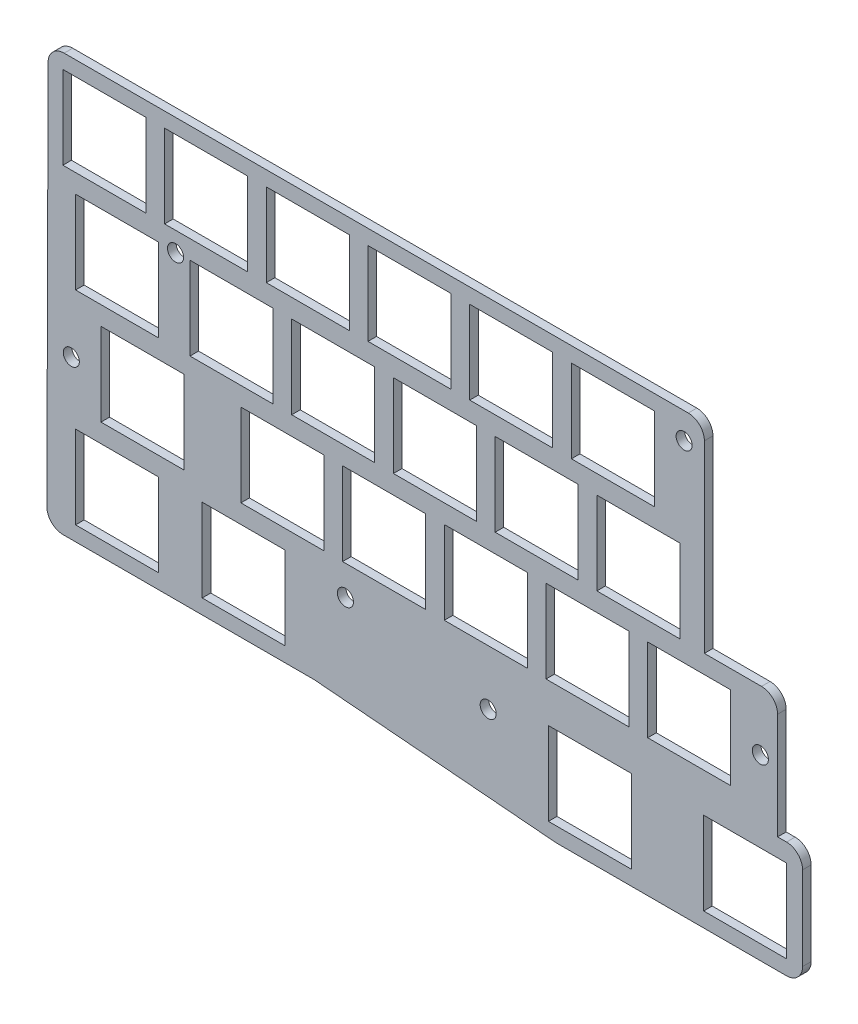
from build123d import *

# Parameters (mm, degrees)
SKETCH1_R           = 1.5
SKETCH1_W           = 15.5
SKETCH1_H           = 15.5
BOSS_EXTRUDE1_DEPTH = 1.6
CUT_EXTRUDE2_DEPTH  = 91.713045172
FILLET2_R           = 3
FILLET3_R           = 3


with BuildPart() as part:
    # Sketch1 → Boss-Extrude1 (new body)
    with BuildSketch(Plane.XY):
        with BuildLine():
            Line((80.807032999, -9.202000204), (80.807032999, 37.709242496))
            ThreePointArc((80.807032999, 37.709242496), (79.927673142, 39.831242844), (77.805109389, 40.709241907))
            Line((77.805109389, 40.709241907), (-72.154484411, 40.613083107))
            ThreePointArc((-72.154484411, 40.613083107), (-74.271159988, 39.737121752), (-75.152545414, 37.622699011))
            Line((-75.152545414, 37.622699011), (-75.383320814, -34.379217889))
            ThreePointArc((-75.383320814, -34.379217889), (-74.508053368, -36.506751286), (-72.383336219, -37.388833194))
            Line((-72.383336219, -37.388833194), (-25.613726719, -37.388833194))
            ThreePointArc((-25.613726719, -37.388833194), (-25.488077715, -37.391465627), (-25.362649219, -37.399358309))
            Line((-25.362649219, -37.399358309), (19.631715181, -41.178308109))
            ThreePointArc((19.631715181, -41.178308109), (19.757143676, -41.18620079), (19.88279268, -41.188833223))
            Line((19.88279268, -41.188833223), (68.14475528, -41.188833223))
            ThreePointArc((68.14475528, -41.188833223), (69.898886106, -40.622559803), (70.990805162, -39.137516598))
            Line((70.990805162, -39.137516598), (80.653082862, -10.150683598))
            ThreePointArc((80.653082862, -10.150683598), (80.768295364, -9.682546983), (80.807032999, -9.202000204))
        make_face()
        with Locations((-19.612967014, -21.188833189)):
            Circle(SKETCH1_R, mode=Mode.SUBTRACT)
        with Locations((7.057032986, -25.938833189)):
            Circle(SKETCH1_R, mode=Mode.SUBTRACT)
        with Locations((43.657032986, 35.811166811)):
            Circle(SKETCH1_R, mode=Mode.SUBTRACT)
        with Locations((-70.817967014, -7.888833189)):
            Circle(SKETCH1_R, mode=Mode.SUBTRACT)
        with Locations((57.907032986, -7.888833189)):
            Circle(SKETCH1_R, mode=Mode.SUBTRACT)
        with Locations((-51.342967014, 18.711166811)):
            Circle(SKETCH1_R, mode=Mode.SUBTRACT)
        with Locations((-64.642967014, 30.111166811)):
            Rectangle(SKETCH1_W, SKETCH1_H, mode=Mode.SUBTRACT)
        with Locations((-45.642967014, 30.111166811)):
            Rectangle(SKETCH1_W, SKETCH1_H, mode=Mode.SUBTRACT)
        with Locations((-26.642967014, 30.111166811)):
            Rectangle(SKETCH1_W, SKETCH1_H, mode=Mode.SUBTRACT)
        with Locations((-7.642967014, 30.111166811)):
            Rectangle(SKETCH1_W, SKETCH1_H, mode=Mode.SUBTRACT)
        with Locations((11.357032986, 30.111166811)):
            Rectangle(SKETCH1_W, SKETCH1_H, mode=Mode.SUBTRACT)
        with Locations((30.357032986, 30.111166811)):
            Rectangle(SKETCH1_W, SKETCH1_H, mode=Mode.SUBTRACT)
        with Locations((-62.267967014, 11.111166811)):
            Rectangle(SKETCH1_W, SKETCH1_H, mode=Mode.SUBTRACT)
        with Locations((-40.892967014, 11.111166811)):
            Rectangle(SKETCH1_W, SKETCH1_H, mode=Mode.SUBTRACT)
        with Locations((-21.892967014, 11.111166811)):
            Rectangle(SKETCH1_W, SKETCH1_H, mode=Mode.SUBTRACT)
        with Locations((-2.892967014, 11.111166811)):
            Rectangle(SKETCH1_W, SKETCH1_H, mode=Mode.SUBTRACT)
        with Locations((16.107032986, 11.111166811)):
            Rectangle(SKETCH1_W, SKETCH1_H, mode=Mode.SUBTRACT)
        with Locations((35.107032986, 11.111166811)):
            Rectangle(SKETCH1_W, SKETCH1_H, mode=Mode.SUBTRACT)
        with Locations((-57.517967014, -7.888833189)):
            Rectangle(SKETCH1_W, SKETCH1_H, mode=Mode.SUBTRACT)
        with Locations((-31.392967014, -7.888833189)):
            Rectangle(SKETCH1_W, SKETCH1_H, mode=Mode.SUBTRACT)
        with Locations((-12.392967014, -7.888833189)):
            Rectangle(SKETCH1_W, SKETCH1_H, mode=Mode.SUBTRACT)
        with Locations((6.607032986, -7.888833189)):
            Rectangle(SKETCH1_W, SKETCH1_H, mode=Mode.SUBTRACT)
        with Locations((25.607032986, -7.888833189)):
            Rectangle(SKETCH1_W, SKETCH1_H, mode=Mode.SUBTRACT)
        with Locations((44.607032986, -7.888833189)):
            Rectangle(SKETCH1_W, SKETCH1_H, mode=Mode.SUBTRACT)
        with Locations((-62.267967014, -26.888833189)):
            Rectangle(SKETCH1_W, SKETCH1_H, mode=Mode.SUBTRACT)
        with Locations((-38.612967014, -26.888833189)):
            Rectangle(SKETCH1_W, SKETCH1_H, mode=Mode.SUBTRACT)
        with Locations((26.057032986, -30.688833189)):
            Rectangle(SKETCH1_W, SKETCH1_H, mode=Mode.SUBTRACT)
        with Locations((55.057032986, -30.688833189)):
            Rectangle(SKETCH1_W, SKETCH1_H, mode=Mode.SUBTRACT)
    extrude(amount=BOSS_EXTRUDE1_DEPTH)

    # Sketch3 → Cut-Extrude2 (cut, through all)
    with BuildSketch(Plane.XY.offset(1.6)):
        Polygon((47.443249451, 42.560753869), (47.443249451, 3.300099698), (61.120116682, 3.300099698), (61.120116682, -19.548313794), (65.786341973, -19.548313794), (65.786341973, -41.188833223), (73.358886795, -43.51481274), (105.294000543, 60.45432308), align=None)
    extrude(amount=-CUT_EXTRUDE2_DEPTH, mode=Mode.SUBTRACT)

    # Fillet2
    fillet2_edges = [part.edges().sort_by_distance(p)[0] for p in [
        (47.443249451, 40.689772929, 0.8),
        (65.786341973, -19.548313794, 0.8),
        (61.120116682, 3.300099698, 0.8),
    ]]
    fillet(fillet2_edges, radius=FILLET2_R)

    # Fillet3
    fillet3_edges = [part.edges().sort_by_distance(p)[0] for p in [
        (65.786341973, -41.188833223, 0.8),
    ]]
    fillet(fillet3_edges, radius=FILLET3_R)


solid = part.part
